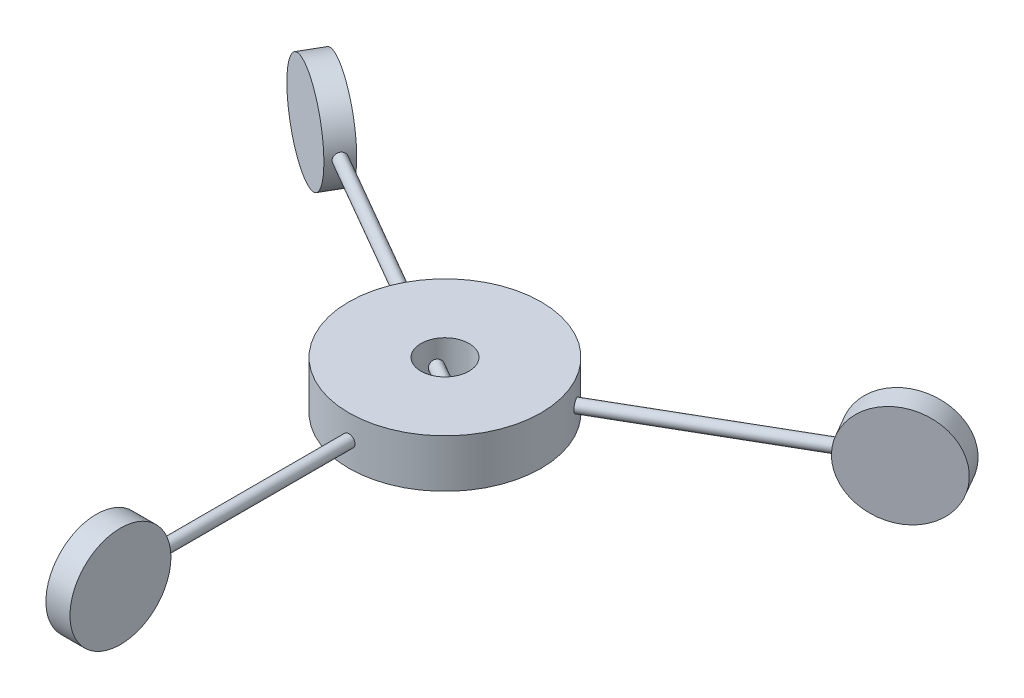
from build123d import *

# Parameters (mm, degrees)
SKETCH1_R                = 25.4
SKETCH1_R_2              = 6.35
BOSS_EXTRUDE1_DEPTH      = 12.7
SKETCH2_R                = 1.5875
BOSS_EXTRUDE2_DEPTH      = 76.2
CIRPATTERN1_COUNT        = 3
BOSS_EXTRUDE3_DEPTH      = 3.175
BOSS_EXTRUDE3_DEPTH_BACK = 3.175
SKETCH3_R                = 13.335
CIRPATTERN10_COUNT       = 3


with BuildPart() as part:
    # Sketch1 → Boss-Extrude1 (new body)
    with BuildSketch(Plane(origin=(0, 0, 0), x_dir=(1, 0, 0), z_dir=(0, 1, 0))):
        Circle(SKETCH1_R)
        Circle(SKETCH1_R_2, mode=Mode.SUBTRACT)
    extrude(amount=BOSS_EXTRUDE1_DEPTH)

    # Sketch2 → Boss-Extrude2 (add)
    with BuildSketch(Plane.XY):
        with Locations((0, 6.35)):
            Circle(SKETCH2_R)
    boss_extrude2 = extrude(amount=BOSS_EXTRUDE2_DEPTH)

    # CirPattern1: Boss-Extrude2 ×3 about axis
    cirpattern1_axis = Axis((0, 12.7, 0), (0, -1, 0))
    for i in range(1, CIRPATTERN1_COUNT):
        add(boss_extrude2.rotate(cirpattern1_axis, i * 360 / CIRPATTERN1_COUNT))


with BuildPart() as body_2:
    # Sketch3 → Boss-Extrude3 (new, two sides: drawn at the far end of the back side and taken through both)
    with BuildSketch(Plane(origin=(0, 0, 0), x_dir=(0, 0, -1), z_dir=(1, 0, 0)).offset(-BOSS_EXTRUDE3_DEPTH_BACK)):
        with Locations((-88.9, 6.35)):
            Circle(SKETCH3_R)
    extrude(amount=BOSS_EXTRUDE3_DEPTH + BOSS_EXTRUDE3_DEPTH_BACK)


with BuildPart() as cirpattern10_1:
    # CirPattern10: pattern copy
    add(body_2.part.rotate(Axis((0, 12.7, 0), (0, -1, 0)), 1 * 360 / CIRPATTERN10_COUNT))


with BuildPart() as cirpattern10_2:
    # CirPattern10: pattern copy
    add(body_2.part.rotate(Axis((0, 12.7, 0), (0, -1, 0)), 2 * 360 / CIRPATTERN10_COUNT))


solid = Compound([part.part, body_2.part, cirpattern10_1.part, cirpattern10_2.part])
